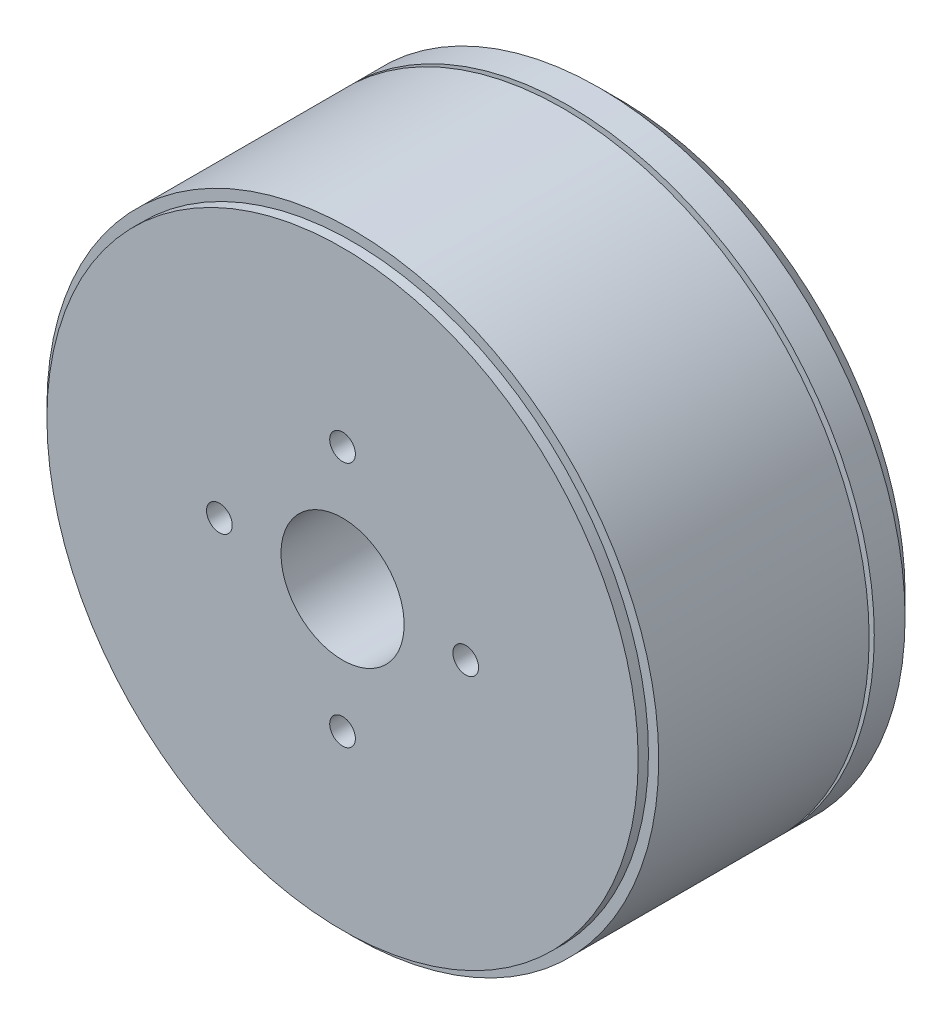
from build123d import *

# Parameters (mm, degrees)
SKETCH_1_R             = 29.8
EXTRUDE_1_DEPTH        = 27
CHAMFER_2_SIZE         = 2
CUT_EXTRUDE_START      = -1
SKETCH_2_R             = 29.8
SKETCH_2_R_2           = 28.8
CUT_EXTRUDE_1_DEPTH    = 1
SKETCH_5_R             = 29.8
SKETCH_5_R_2           = 4.3
CUT_EXTRUDE_2_DEPTH    = 0.5
HOLE_WIZARD_M3_1_D     = 2.5
HOLE_WIZARD_M3_1_DEPTH = 10
HOLE_WIZARD_M3_1_TIP   = 0.751075774
HOLE_WIZARD_M3_2_D     = 2.5
HOLE_WIZARD_M3_2_DEPTH = 5
HOLE_WIZARD_M2_1_D     = 1.6
HOLE_WIZARD_M2_1_DEPTH = 5
SKETCH_15_W            = 15
SKETCH_15_H            = 11
CUT_EXTRUDE_3_DEPTH    = 0.05
FILLET_1_R             = 1
EXTRUDE_4_DEPTH        = 0.025
SKETCH_17_R            = 12
SKETCH_17_R_2          = 10.5
CUT_EXTRUDE_4_DEPTH    = 0.5
SKETCH_18_R            = 6
CUT_EXTRUDE_6_DEPTH    = 51.05077422
SKETCH_19_R            = 6
SKETCH_19_R_2          = 3
EXTRUDE_5_DEPTH        = 5


with BuildPart() as part:
    # 草图1 → 凸台-拉伸1 (new body)
    with BuildSketch(Plane.XY):
        Circle(SKETCH_1_R)
    extrude(amount=EXTRUDE_1_DEPTH)

    # 倒角2
    chamfer_2_edges = [part.edges().sort_by_distance(p)[0] for p in [
        (-29.8, 0, 0),
    ]]
    chamfer(chamfer_2_edges, length=CHAMFER_2_SIZE)

    # 草图2 → 切除-拉伸1 (cut)
    with BuildSketch(Plane.XY.offset(27).offset(CUT_EXTRUDE_START)):
        Circle(SKETCH_2_R)
        Circle(SKETCH_2_R_2, mode=Mode.SUBTRACT)
    extrude(amount=CUT_EXTRUDE_1_DEPTH, mode=Mode.SUBTRACT)

    # 草图5 → 切除-拉伸2 (cut)
    with BuildSketch(Plane(origin=(0, 0, 5), x_dir=(-1, 0, 0), z_dir=(0, 0, -1))):
        Circle(SKETCH_5_R)
        Circle(SKETCH_5_R_2, mode=Mode.SUBTRACT)
    extrude(amount=-CUT_EXTRUDE_2_DEPTH, mode=Mode.SUBTRACT)

    # M3 螺纹孔的螺纹孔钻头1
    with Locations(Plane.XY.offset(27)):
        with Locations((-12, 0), (12, 0), (0, 12), (0, -12)):
            Hole(HOLE_WIZARD_M3_1_D / 2, depth=HOLE_WIZARD_M3_1_DEPTH)
            with Locations((0, 0, -(HOLE_WIZARD_M3_1_DEPTH + HOLE_WIZARD_M3_1_TIP / 2))):  # 118° drill point
                Cone(0, HOLE_WIZARD_M3_1_D / 2, HOLE_WIZARD_M3_1_TIP, mode=Mode.SUBTRACT)

    # M3 螺纹孔的螺纹孔钻头2
    with Locations(Plane(origin=(0, 0, 0), x_dir=(-1, 0, 0), z_dir=(0, 0, -1))):
        with Locations((17.67766953, 17.67766953), (-17.67766953, 17.67766953), (-17.67766953, -17.67766953), (17.67766953, -17.67766953)):
            Hole(HOLE_WIZARD_M3_2_D / 2, depth=HOLE_WIZARD_M3_2_DEPTH)

    # M2 螺纹孔的螺纹孔钻头1
    with Locations(Plane(origin=(0, 0, 0), x_dir=(-1, 0, 0), z_dir=(0, 0, -1))):
        with Locations((-9.545941546, 9.545941546), (9.545941546, 9.545941546), (9.545941546, -9.545941546), (-9.545941546, -9.545941546)):
            Hole(HOLE_WIZARD_M2_1_D / 2, depth=HOLE_WIZARD_M2_1_DEPTH)

    # 草图15 → 切除-拉伸3 (cut)
    with BuildSketch(Plane(origin=(0, 0, 0), x_dir=(-1, 0, 0), z_dir=(0, 0, -1))):
        with Locations((0, -19.5)):
            Rectangle(SKETCH_15_W, SKETCH_15_H)
    extrude(amount=-CUT_EXTRUDE_3_DEPTH, mode=Mode.SUBTRACT)

    # 圆角1
    fillet_1_edges = [part.edges().sort_by_distance(p)[0] for p in [
        (7.5, -25, 0.025),
        (7.5, -14, 0.025),
        (-7.5, -14, 0.025),
        (-7.5, -25, 0.025),
    ]]
    fillet(fillet_1_edges, radius=FILLET_1_R)

    # 草图16 → 凸台-拉伸4 (add)
    with BuildSketch(Plane(origin=(0, 0, 0.05), x_dir=(-1, 0, 0), z_dir=(0, 0, -1))):
        with BuildLine():
            Line((1.74, -23.5), (1.74, -20.96))
            ThreePointArc((1.74, -20.96), (2.54, -20.16), (3.34, -20.96))
            Line((3.34, -20.96), (3.34, -23.5))
            ThreePointArc((3.34, -23.5), (2.54, -24.3), (1.74, -23.5))
        make_face()
        with BuildLine():
            Line((0.8, -20.96), (0.8, -23.5))
            ThreePointArc((0.8, -23.5), (0, -24.3), (-0.8, -23.5))
            Line((-0.8, -23.5), (-0.8, -20.96))
            ThreePointArc((-0.8, -20.96), (0, -20.16), (0.8, -20.96))
        make_face()
        with BuildLine():
            Line((-1.74, -20.96), (-1.74, -23.5))
            ThreePointArc((-1.74, -23.5), (-2.54, -24.3), (-3.34, -23.5))
            Line((-3.34, -23.5), (-3.34, -20.96))
            ThreePointArc((-3.34, -20.96), (-2.54, -20.16), (-1.74, -20.96))
        make_face()
    extrude(amount=EXTRUDE_4_DEPTH)

    # 草图17 → 切除-拉伸4 (cut)
    with BuildSketch(Plane(origin=(0, 0, 0), x_dir=(-1, 0, 0), z_dir=(0, 0, -1))):
        Circle(SKETCH_17_R)
        Circle(SKETCH_17_R_2, mode=Mode.SUBTRACT)
    extrude(amount=-CUT_EXTRUDE_4_DEPTH, mode=Mode.SUBTRACT)

    # 草图18 → 切除-拉伸6 (cut, through all)
    with BuildSketch(Plane(origin=(0, 0, 0), x_dir=(-1, 0, 0), z_dir=(0, 0, -1))):
        Circle(SKETCH_18_R)
    extrude(amount=-CUT_EXTRUDE_6_DEPTH, mode=Mode.SUBTRACT)


with BuildPart() as cut_extrude_6_piece_1:
    # of the separate pieces the step leaves, piece 1, a body of its own (cut_extrude_6_pieces)
    add(part.part.solids().sort_by_distance((29.8, 0, 5.5))[0])


with BuildPart() as cut_extrude_6_piece_2:
    # of the separate pieces the step leaves, piece 2, a body of its own (cut_extrude_6_pieces)
    add(part.part.solids().sort_by_distance((27.8, 0, 0))[0])


with BuildPart() as body_3:
    # 草图19 → 凸台-拉伸5 (new body)
    with BuildSketch(Plane(origin=(0, 0, 0), x_dir=(-1, 0, 0), z_dir=(0, 0, -1))):
        Circle(SKETCH_19_R)
        Circle(SKETCH_19_R_2, mode=Mode.SUBTRACT)
    extrude(amount=-EXTRUDE_5_DEPTH)


solid = Compound([cut_extrude_6_piece_1.part, cut_extrude_6_piece_2.part, body_3.part])
